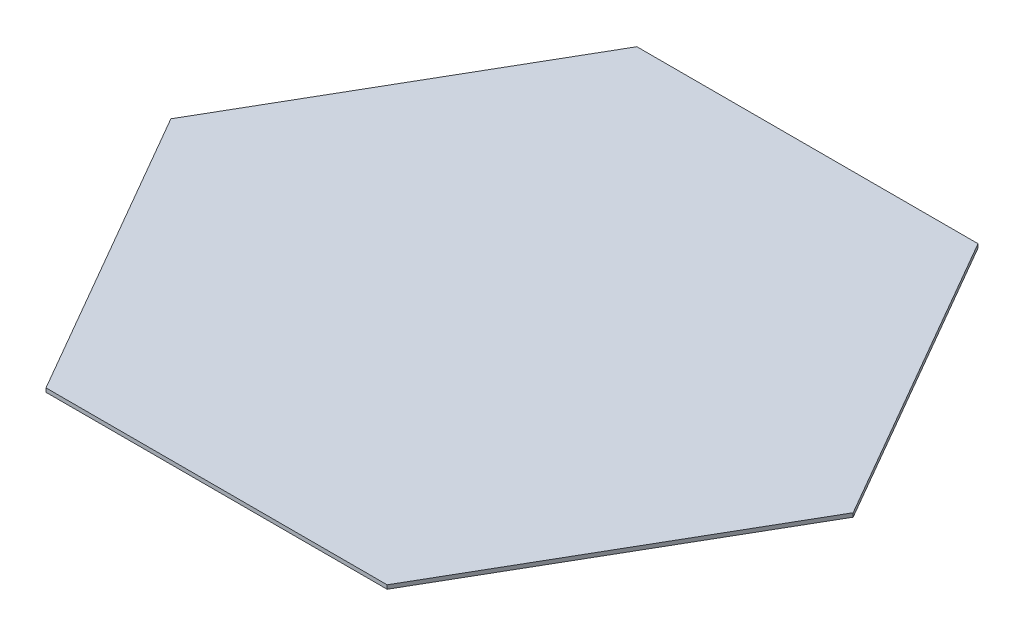
from build123d import *

# Parameters (mm, degrees)
BOSS_EXTRU_1_DEPTH = 5


with BuildPart() as part:
    # Esquisse1 → Boss.-Extru.1 (new body)
    with BuildSketch(Plane(origin=(0, 0, 0), x_dir=(1, 0, 0), z_dir=(0, 1, 0))):
        Polygon((220, 381.051177665), (-220, 381.051177665), (-440, 0), (-220, -381.051177665), (220, -381.051177665), (440, 0), align=None)
    extrude(amount=BOSS_EXTRU_1_DEPTH)


solid = part.part
